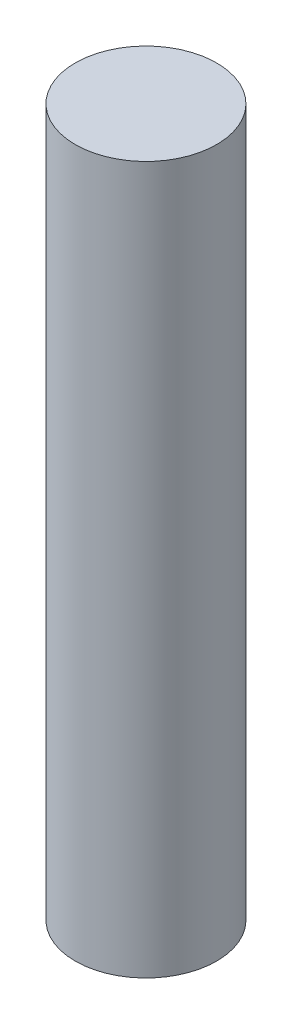
from build123d import *

# Parameters (mm, degrees)
SKETCH1_R           = 5
BOSS_EXTRUDE1_DEPTH = 50


with BuildPart() as part:
    # Sketch1 → Boss-Extrude1 (new body)
    with BuildSketch(Plane(origin=(0, 0, 0), x_dir=(1, 0, 0), z_dir=(0, 1, 0))):
        with Locations(Location((0, 0, 0), (0, 0, 270))):
            Circle(SKETCH1_R)
    extrude(amount=BOSS_EXTRUDE1_DEPTH)


solid = part.part
